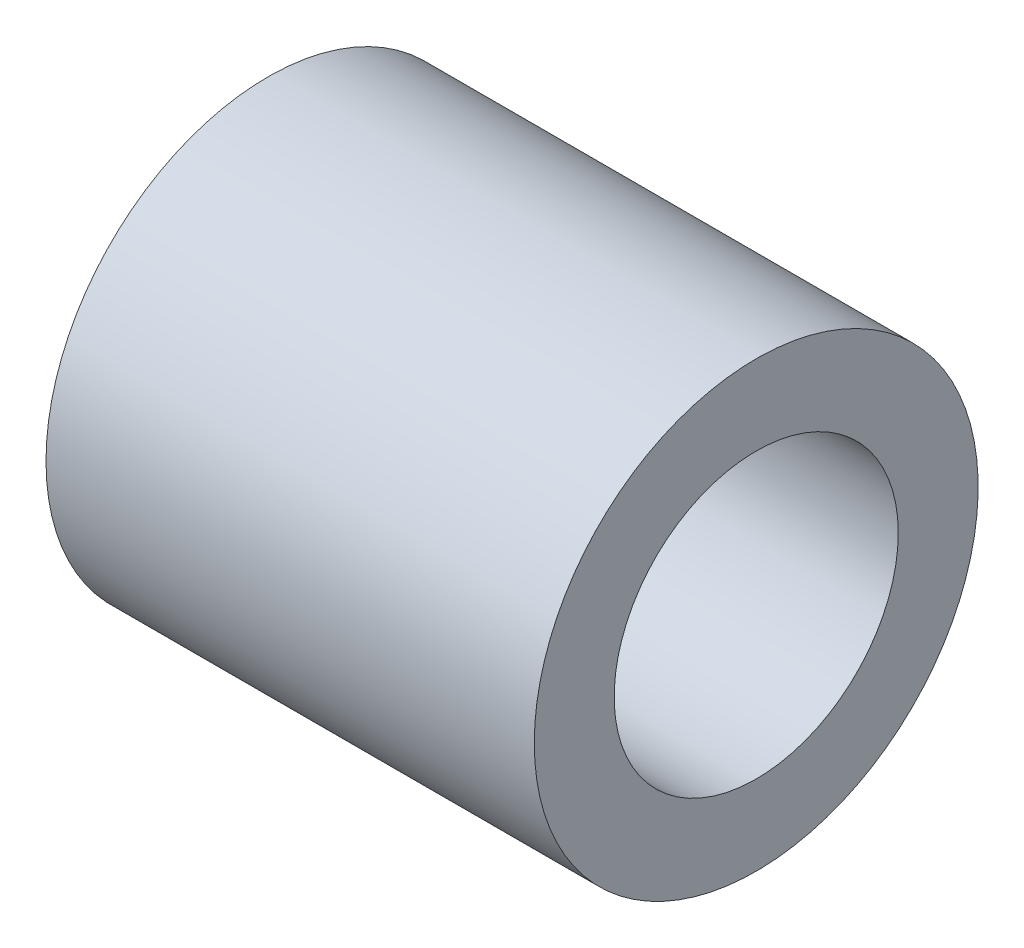
from build123d import *

# Parameters (mm, degrees)
SKIZZE1_W                       = 5.5
SKIZZE1_H                       = 2.5
SKIZZE2_R                       = 1.6
SCHNITT_LINEAR_AUSTRAGEN1_DEPTH = 5.5


with BuildPart() as part:
    # Skizze1 → Rotation1 (revolve)
    with BuildSketch(Plane.XY, mode=Mode.PRIVATE) as rotation1_sk:
        with Locations((2.75, 1.25)):
            Rectangle(SKIZZE1_W, SKIZZE1_H)
    revolve(rotation1_sk.sketch.rotate(Axis((0, 0, 0), (1, 0, 0)), 90), axis=Axis((0, 0, 0), (1, 0, 0)))

    # Skizze2 → Schnitt-Linear austragen1 (cut)
    with BuildSketch(Plane(origin=(5.5, 0, 0), x_dir=(0, 0, -1), z_dir=(1, 0, 0))):
        Circle(SKIZZE2_R)
    extrude(amount=-SCHNITT_LINEAR_AUSTRAGEN1_DEPTH, mode=Mode.SUBTRACT)


solid = part.part
